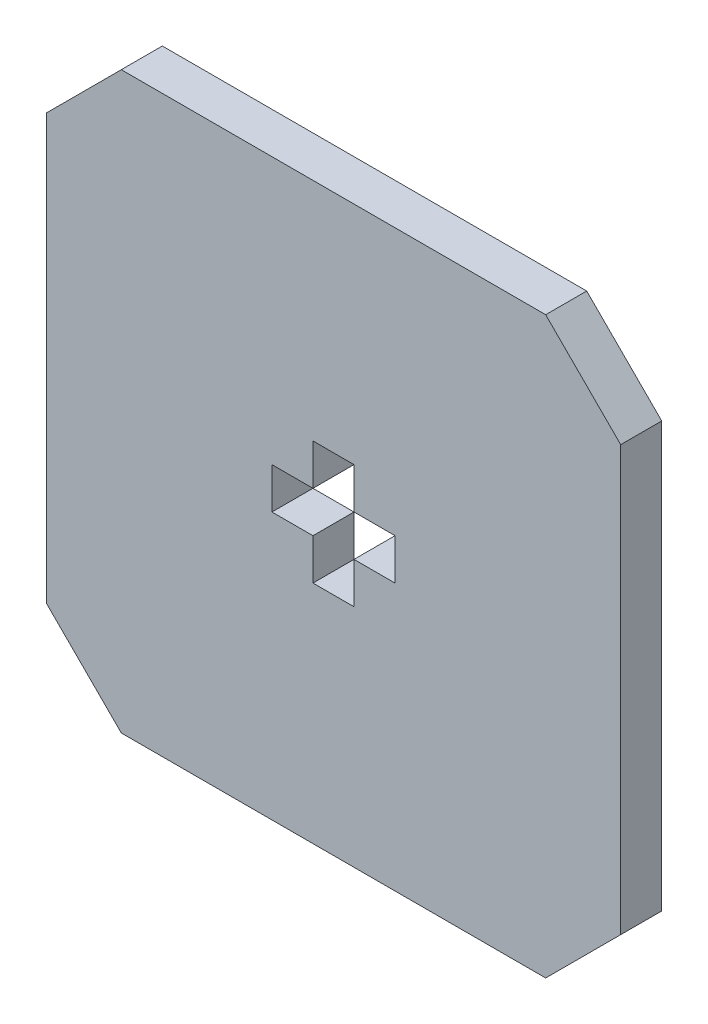
from build123d import *

# Parameters (mm, degrees)
BOSS_EXTRUDE1_DEPTH = 3


with BuildPart() as part:
    # Sketch1 → Boss-Extrude1 (new body)
    with BuildSketch(Plane.XY):
        Polygon((426.514723486, 254.99999521), (395.485286234, 254.99999521), (390.00000486, 260.485276584), (390.00000486, 291.514713836), (395.485286234, 296.99999521), (426.514723486, 296.99999521), (432.00000486, 291.514713836), (432.00000486, 260.485276584), align=None)
        Polygon((412.50000486, 280.49999521), (412.50000486, 277.49999521), (415.50000486, 277.49999521), (415.50000486, 274.49999521), (412.50000486, 274.49999521), (412.50000486, 271.49999521), (409.50000486, 271.49999521), (409.50000486, 274.49999521), (406.50000486, 274.49999521), (406.50000486, 277.49999521), (409.50000486, 277.49999521), (409.50000486, 280.49999521), align=None, mode=Mode.SUBTRACT)
    extrude(amount=BOSS_EXTRUDE1_DEPTH)


solid = part.part
